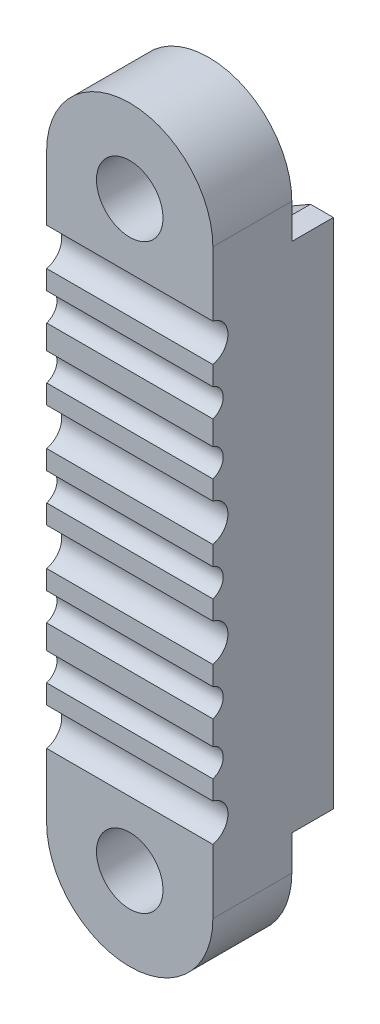
from build123d import *

# Parameters (mm, degrees)
SKETCH_2_R          = 1.6
EXTRUDE_1_DEPTH     = 3.8
CUT_EXTRUDE_1_REACH = 22.061
SKETCH_3_R          = 0.925
SKETCH_3_R_2        = 0.7
EXTRUDE_2_DEPTH     = 2


with BuildPart() as part:
    # Эскиз2 → Бобышка-Вытянуть1 (new body)
    with BuildSketch(Plane.XY):
        with BuildLine():
            Line((-14.886464029, 14), (-14.886464029, -14))
            ThreePointArc((-14.886464029, -14), (-10.886464029, -18), (-6.886464029, -14))
            Line((-6.886464029, -14), (-6.886464029, 14))
            ThreePointArc((-6.886464029, 14), (-10.886464029, 18), (-14.886464029, 14))
        make_face()
        with Locations(Location((-10.886464029, -14, 0), (0, 0, 180))):
            Circle(SKETCH_2_R, mode=Mode.SUBTRACT)
        with Locations(Location((-10.886464029, 14, 0), (0, 0, 180))):
            Circle(SKETCH_2_R, mode=Mode.SUBTRACT)
    extrude(amount=EXTRUDE_1_DEPTH)

    # Эскиз3 → Вырез-Вытянуть1 (cut, up to next)
    with BuildSketch(Plane.ZY.offset(14.886464029), mode=Mode.PRIVATE) as cut_extrude_1_sk1:
        with Locations((4, -10)):
            Circle(SKETCH_3_R)
    cut_extrude_1_tool1 = extrude(cut_extrude_1_sk1.sketch, amount=-CUT_EXTRUDE_1_REACH, mode=Mode.PRIVATE) & part.part
    # Эскиз3 → Вырез-Вытянуть1 (cut, up to next)
    with BuildSketch(Plane.ZY.offset(14.886464029), mode=Mode.PRIVATE) as cut_extrude_1_sk2:
        with Locations((4, -7.5)):
            Circle(SKETCH_3_R_2)
    cut_extrude_1_tool2 = extrude(cut_extrude_1_sk2.sketch, amount=-CUT_EXTRUDE_1_REACH, mode=Mode.PRIVATE) & part.part
    # Эскиз3 → Вырез-Вытянуть1 (cut, up to next)
    with BuildSketch(Plane.ZY.offset(14.886464029), mode=Mode.PRIVATE) as cut_extrude_1_sk3:
        with Locations((4, -5)):
            Circle(SKETCH_3_R_2)
    cut_extrude_1_tool3 = extrude(cut_extrude_1_sk3.sketch, amount=-CUT_EXTRUDE_1_REACH, mode=Mode.PRIVATE) & part.part
    # Эскиз3 → Вырез-Вытянуть1 (cut, up to next)
    with BuildSketch(Plane.ZY.offset(14.886464029), mode=Mode.PRIVATE) as cut_extrude_1_sk4:
        with Locations((4, 10)):
            Circle(SKETCH_3_R)
    cut_extrude_1_tool4 = extrude(cut_extrude_1_sk4.sketch, amount=-CUT_EXTRUDE_1_REACH, mode=Mode.PRIVATE) & part.part
    # Эскиз3 → Вырез-Вытянуть1 (cut, up to next)
    with BuildSketch(Plane.ZY.offset(14.886464029), mode=Mode.PRIVATE) as cut_extrude_1_sk5:
        with Locations((4, 7.5)):
            Circle(SKETCH_3_R_2)
    cut_extrude_1_tool5 = extrude(cut_extrude_1_sk5.sketch, amount=-CUT_EXTRUDE_1_REACH, mode=Mode.PRIVATE) & part.part
    # Эскиз3 → Вырез-Вытянуть1 (cut, up to next)
    with BuildSketch(Plane.ZY.offset(14.886464029), mode=Mode.PRIVATE) as cut_extrude_1_sk6:
        with Locations((4, 5)):
            Circle(SKETCH_3_R_2)
    cut_extrude_1_tool6 = extrude(cut_extrude_1_sk6.sketch, amount=-CUT_EXTRUDE_1_REACH, mode=Mode.PRIVATE) & part.part
    # Эскиз3 → Вырез-Вытянуть1 (cut, up to next)
    with BuildSketch(Plane.ZY.offset(14.886464029), mode=Mode.PRIVATE) as cut_extrude_1_sk7:
        with Locations((4, 2.5)):
            Circle(SKETCH_3_R)
    cut_extrude_1_tool7 = extrude(cut_extrude_1_sk7.sketch, amount=-CUT_EXTRUDE_1_REACH, mode=Mode.PRIVATE) & part.part
    # Эскиз3 → Вырез-Вытянуть1 (cut, up to next)
    with BuildSketch(Plane.ZY.offset(14.886464029), mode=Mode.PRIVATE) as cut_extrude_1_sk8:
        with Locations((4, 0)):
            Circle(SKETCH_3_R_2)
    cut_extrude_1_tool8 = extrude(cut_extrude_1_sk8.sketch, amount=-CUT_EXTRUDE_1_REACH, mode=Mode.PRIVATE) & part.part
    # Эскиз3 → Вырез-Вытянуть1 (cut, up to next)
    with BuildSketch(Plane.ZY.offset(14.886464029), mode=Mode.PRIVATE) as cut_extrude_1_sk9:
        with Locations((4, -2.5)):
            Circle(SKETCH_3_R)
    cut_extrude_1_tool9 = extrude(cut_extrude_1_sk9.sketch, amount=-CUT_EXTRUDE_1_REACH, mode=Mode.PRIVATE) & part.part
    add(cut_extrude_1_tool1.solids().sort_by_distance((-14.886464, -10, 4))[0], mode=Mode.SUBTRACT)
    add(cut_extrude_1_tool2.solids().sort_by_distance((-14.886464, -7.5, 4))[0], mode=Mode.SUBTRACT)
    add(cut_extrude_1_tool3.solids().sort_by_distance((-14.886464, -5, 4))[0], mode=Mode.SUBTRACT)
    add(cut_extrude_1_tool4.solids().sort_by_distance((-14.886464, 10, 4))[0], mode=Mode.SUBTRACT)
    add(cut_extrude_1_tool5.solids().sort_by_distance((-14.886464, 7.5, 4))[0], mode=Mode.SUBTRACT)
    add(cut_extrude_1_tool6.solids().sort_by_distance((-14.886464, 5, 4))[0], mode=Mode.SUBTRACT)
    add(cut_extrude_1_tool7.solids().sort_by_distance((-14.886464, 2.5, 4))[0], mode=Mode.SUBTRACT)
    add(cut_extrude_1_tool8.solids().sort_by_distance((-14.886464, 0, 4))[0], mode=Mode.SUBTRACT)
    add(cut_extrude_1_tool9.solids().sort_by_distance((-14.886464, -2.5, 4))[0], mode=Mode.SUBTRACT)

    # Эскиз4 → Бобышка-Вытянуть2 (add)
    with BuildSketch(Plane(origin=(0, 0, 0), x_dir=(-1, 0, 0), z_dir=(0, 0, -1))):
        Polygon((10.886464029, 10.651368439), (13.786464029, 12.325684219), (14.886464029, 12.325684219), (14.886464029, -12.325684219), (13.786464029, -12.325684219), (10.886464029, -10.651368439), (7.986464029, -12.325684219), (6.886464029, -12.325684219), (6.886464029, 12.325684219), (7.986464029, 12.325684219), align=None)
    extrude(amount=EXTRUDE_2_DEPTH)


solid = part.part
